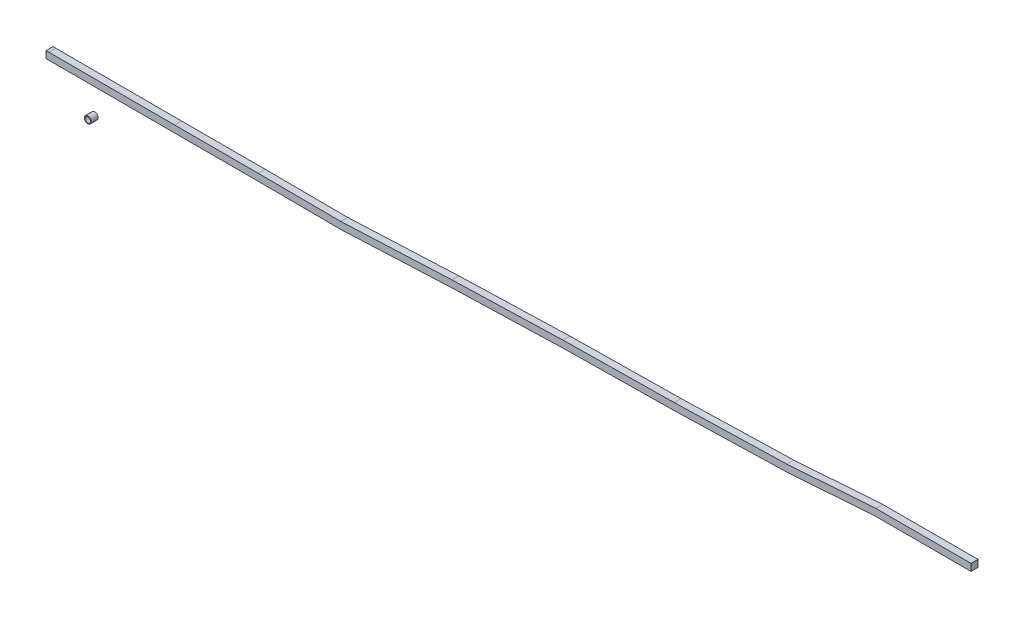
from build123d import *

# Parameters (mm, degrees)
MODEL_R           = 2.5
MODEL_R_2         = 2
EXTRUDE_1_DEPTH   = 5
EXTRUDE_1_2_DEPTH = 5


with BuildPart() as part:
    # Model → 凸台-拉伸1 (new body)
    with BuildSketch(Plane.XY):
        with Locations((136.352657781, -78.772888915)):
            Circle(MODEL_R)
        with Locations((136.352657781, -78.772888915)):
            Circle(MODEL_R_2, mode=Mode.SUBTRACT)
    extrude(amount=EXTRUDE_1_DEPTH)


with BuildPart() as body_2:
    # Model → Extrude 1 2 (new body)
    with BuildSketch(Plane.XY):
        Polygon((639.385053073, -46.813763988), (703.528398771, -42.42077719), (771.971701744, -42.42077719), (771.971701744, -37.42077719), (703.528398771, -37.42077719), (639.385053073, -41.813763988), (558.344709294, -43.989749553), (478.385053073, -45.081007644), (398.350063341, -47.503171379), (318.379120522, -51.094565155), (259.129657458, -50.761885212), (198.772250415, -50.761885212), (108.322443372, -50.666524546), (106.322443372, -50.666524546), (106.322443372, -55.666524546), (108.322443372, -55.666524546), (198.772250415, -55.761885212), (259.129657458, -55.761885212), (318.379120522, -56.094565155), (398.350063341, -52.503171379), (478.385053073, -50.081007644), (558.344709294, -48.989749553), align=None)
    extrude(amount=EXTRUDE_1_2_DEPTH)


solid = Compound([part.part, body_2.part])
